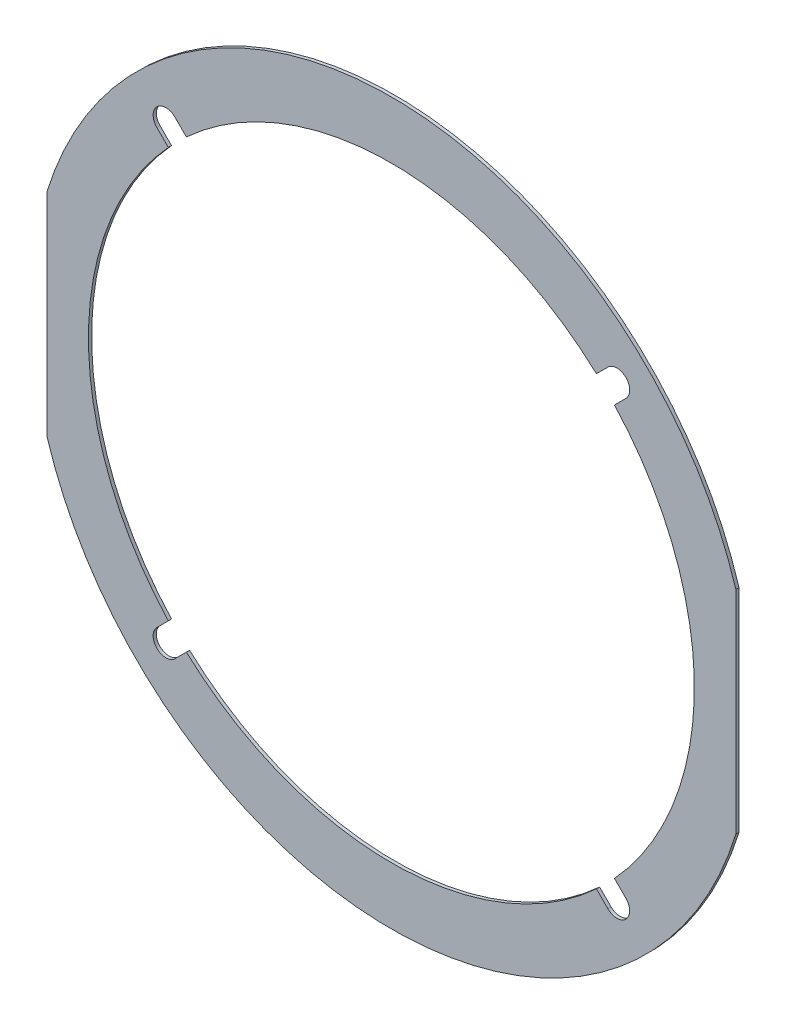
from build123d import *

# Parameters (mm, degrees)
BOSS_EXTRUDE2_DEPTH = 0.25


with BuildPart() as part:
    # Sketch1 → Boss-Extrude2 (new body)
    with BuildSketch(Plane(origin=(0, 0, 0), x_dir=(-1, 0, 0), z_dir=(0, 0, 1))):
        with BuildLine():
            ThreePointArc((27, 8.310385069), (0, 28.25), (-27, 8.310385069))
            Line((-27, 8.310385069), (-27, -8.310385069))
            ThreePointArc((-27, -8.310385069), (0, -28.25), (27, -8.310385069))
            Line((27, -8.310385069), (27, 8.310385069))
        make_face()
        with BuildLine():
            Line((18.384776311, 16.970562748), (17.485999772, 16.07178621))
            ThreePointArc((17.485999772, 16.07178621), (22.128657829, 8.624674064), (23.75, 0))
            ThreePointArc((23.75, 0), (22.128657829, -8.624674064), (17.485999772, -16.07178621))
            Line((17.485999772, -16.07178621), (18.384776311, -16.970562748))
            ThreePointArc((18.384776311, -16.970562748), (18.384776311, -18.384776311), (16.970562748, -18.384776311))
            Line((16.970562748, -18.384776311), (16.07178621, -17.485999772))
            ThreePointArc((16.07178621, -17.485999772), (0, -23.75), (-16.07178621, -17.485999772))
            Line((-16.07178621, -17.485999772), (-16.970562748, -18.384776311))
            ThreePointArc((-16.970562748, -18.384776311), (-18.384776311, -18.384776311), (-18.384776311, -16.970562748))
            Line((-18.384776311, -16.970562748), (-17.485999772, -16.07178621))
            ThreePointArc((-17.485999772, -16.07178621), (-23.75, 0), (-17.485999772, 16.07178621))
            Line((-17.485999772, 16.07178621), (-18.384776311, 16.970562748))
            ThreePointArc((-18.384776311, 16.970562748), (-18.384776311, 18.384776311), (-16.970562748, 18.384776311))
            Line((-16.970562748, 18.384776311), (-16.07178621, 17.485999772))
            ThreePointArc((-16.07178621, 17.485999772), (0, 23.75), (16.07178621, 17.485999772))
            Line((16.07178621, 17.485999772), (16.970562748, 18.384776311))
            ThreePointArc((16.970562748, 18.384776311), (18.384776311, 18.384776311), (18.384776311, 16.970562748))
        make_face(mode=Mode.SUBTRACT)
    extrude(amount=BOSS_EXTRUDE2_DEPTH)


solid = part.part
